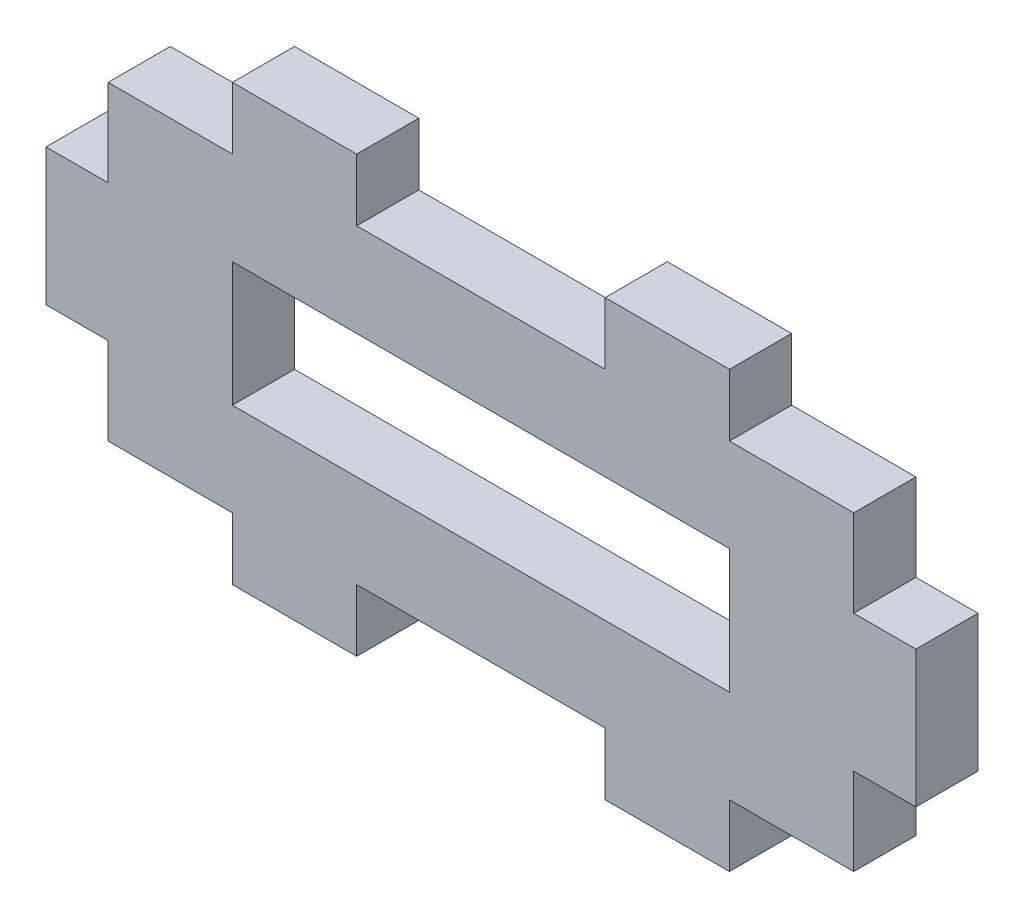
from build123d import *

# Parameters (mm, degrees)
SKETCH1_W           = 40
SKETCH1_H           = 10
BOSS_EXTRUDE1_DEPTH = 5


with BuildPart() as part:
    # Sketch1 → Boss-Extrude1 (new body)
    with BuildSketch(Plane.XY):
        Polygon((-30, -12.5), (-20, -12.5), (-20, -17.5), (-10, -17.5), (-10, -12.5), (10, -12.5), (10, -17.5), (20, -17.5), (20, -12.5), (30, -12.5), (30, -5.5), (35, -5.5), (35, 5.5), (30, 5.5), (30, 12.5), (20, 12.5), (20, 17.5), (10, 17.5), (10, 12.5), (-10, 12.5), (-10, 17.5), (-20, 17.5), (-20, 12.5), (-30, 12.5), (-30, 5.5), (-35, 5.5), (-35, -5.5), (-30, -5.5), align=None)
        Rectangle(SKETCH1_W, SKETCH1_H, mode=Mode.SUBTRACT)
    extrude(amount=BOSS_EXTRUDE1_DEPTH)


solid = part.part
